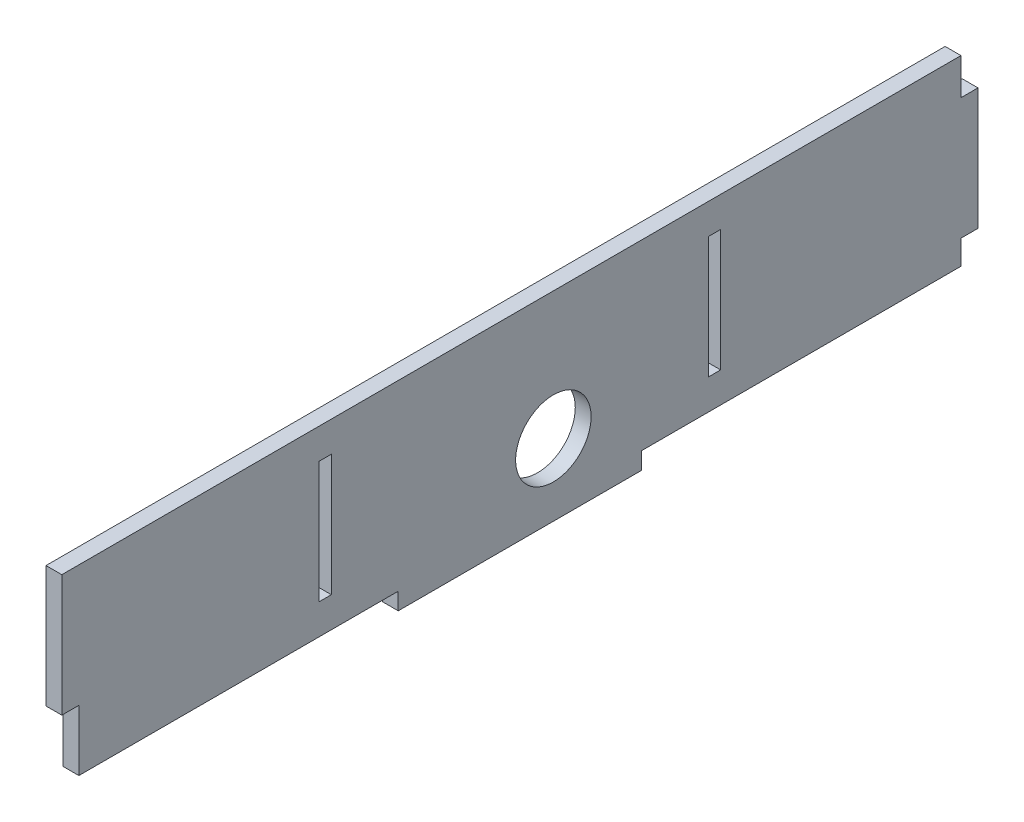
from build123d import *

# Parameters (mm, degrees)
SKETCH1_W           = 72.5
SKETCH1_H           = 15
BOSS_EXTRUDE1_DEPTH = 1.3
SKETCH2_W           = 1.4
SKETCH2_H           = 10
SKETCH2_W_2         = 20
SKETCH2_H_2         = 1.4
BOSS_EXTRUDE2_DEPTH = 1.3
SKETCH3_W           = 1
SKETCH3_H           = 10
CUT_EXTRUDE1_DEPTH  = 39.709462667
SKETCH4_R           = 3.1
CUT_EXTRUDE2_DEPTH  = 39.709462667


with BuildPart() as part:
    # Sketch1 → Boss-Extrude1 (new body)
    with BuildSketch(Plane(origin=(0, 0, 0), x_dir=(0, 0, -1), z_dir=(1, 0, 0))):
        Rectangle(SKETCH1_W, SKETCH1_H)
    extrude(amount=BOSS_EXTRUDE1_DEPTH)

    # Sketch2 → Boss-Extrude2 (add)
    with BuildSketch(Plane(origin=(1.3, 0, 0), x_dir=(0, 0, -1), z_dir=(1, 0, 0))):
        with Locations((-36.95, 2.5)):
            Rectangle(SKETCH2_W, SKETCH2_H)
        with Locations((36.95, -0.5)):
            Rectangle(SKETCH2_W, SKETCH2_H)
        with Locations((0, -8.2)):
            Rectangle(SKETCH2_W_2, SKETCH2_H_2)
    extrude(amount=-BOSS_EXTRUDE2_DEPTH)

    # Sketch3 → Cut-Extrude1 (cut, through all)
    with BuildSketch(Plane(origin=(1.3, 0, 0), x_dir=(0, 0, -1), z_dir=(1, 0, 0))):
        with Locations((16, 0)):
            Rectangle(SKETCH3_W, SKETCH3_H)
        with Locations((-16, 0)):
            Rectangle(SKETCH3_W, SKETCH3_H)
    extrude(amount=-CUT_EXTRUDE1_DEPTH, mode=Mode.SUBTRACT)

    # Sketch4 → Cut-Extrude2 (cut, through all)
    with BuildSketch(Plane(origin=(1.3, 0, 0), x_dir=(0, 0, -1), z_dir=(1, 0, 0))):
        with Locations((2.75, -3)):
            Circle(SKETCH4_R)
    extrude(amount=-CUT_EXTRUDE2_DEPTH, mode=Mode.SUBTRACT)


solid = part.part
